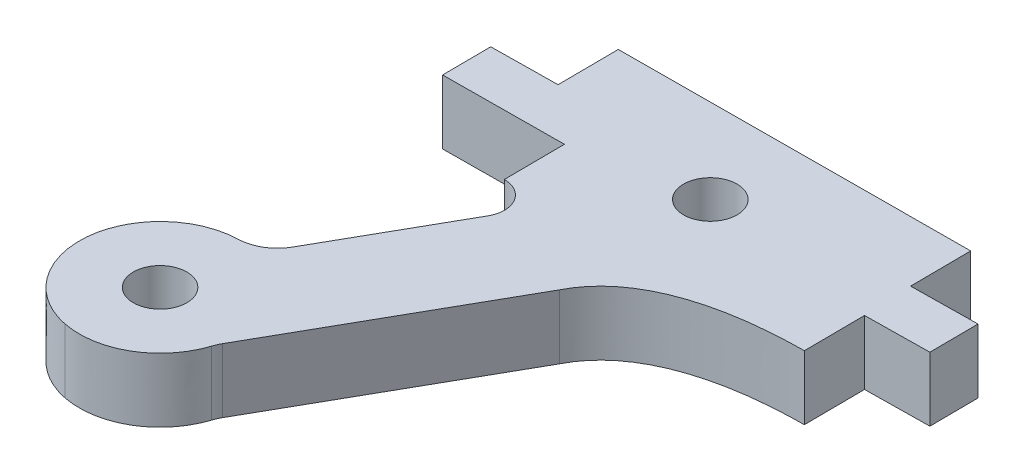
from build123d import *

# Parameters (mm, degrees)
SKETCH1_R           = 1.32389541
SKETCH1_R_2         = 1.323699758
BOSS_EXTRUDE1_DEPTH = 3.175


with BuildPart() as part:
    # Sketch1 → Boss-Extrude1 (new body)
    with BuildSketch(Plane(origin=(0, 0, 0), x_dir=(1, 0, 0), z_dir=(0, 1, 0))):
        with BuildLine():
            Line((-5.766463736, 10.436835071), (-5.763397789, 10.436835071))
            Line((-5.763397789, 10.436835071), (-5.741482849, 7.436754545))
            Line((-5.741482849, 7.436754545), (-5.741482849, 7.43457666))
            Line((-5.741482849, 7.43457666), (-9.035328609, 7.392845258))
            Line((-9.035328609, 7.392845258), (-9.017756687, 4.992874594))
            Line((-9.017756687, 4.992874594), (-3.028577982, 5.036774114))
            Line((-3.028577982, 5.036774114), (-3.006858015, 2.03663499))
            add(Edge.make_bspline(
                [(-3.006858015, 2.03663499), (-2.537212459, 2.04027782), (-2.101492166, 1.792457947), (-1.86369849, 1.386795127)],
                knots=[7, 7, 7, 7, 8, 8, 8, 8], degree=3))
            add(Edge.make_bspline(
                [(-1.86369849, 1.386795127), (-1.625904815, 0.981269034), (-1.622327064, 0.479281193), (-1.854110704, 0.070102504)],
                knots=[8, 8, 8, 8, 9, 9, 9, 9], degree=3))
            Line((-1.854110704, 0.070102504), (-5.351888242, -6.103195522))
            add(Edge.make_bspline(
                [(-5.351888242, -6.103195522), (-5.695800728, -6.710083196), (-6.330407878, -7.093469085), (-7.026733662, -7.115042842)],
                knots=[10, 10, 10, 10, 11, 11, 11, 11], degree=3))
            add(Edge.make_bspline(
                [(-7.026733662, -7.115042842), (-9.053280728, -7.177635062), (-10.711446226, -8.751884558), (-10.882412982, -10.775901488)],
                knots=[11, 11, 11, 11, 12, 12, 12, 12], degree=3))
            add(Edge.make_bspline(
                [(-10.882412982, -10.775901488), (-11.053189639, -12.799977016), (-9.682969691, -14.630953252), (-7.695582907, -15.033920574)],
                knots=[12, 12, 12, 12, 13, 13, 13, 13], degree=3))
            add(Edge.make_bspline(
                [(-7.695582907, -15.033920574), (-5.708322855, -15.436702335), (-3.735061849, -14.283722207), (-3.107161762, -12.352201909)],
                knots=[13, 13, 13, 13, 14, 14, 14, 14], degree=3))
            add(Edge.make_bspline(
                [(-3.107161762, -12.352201909), (-3.065505827, -12.224448933), (-3.011327766, -12.101305651), (-2.945076016, -11.984237008)],
                knots=[14, 14, 14, 14, 15, 15, 15, 15], degree=3))
            Line((-2.945076016, -11.984237008), (3.088122669, -1.336147093))
            add(Edge.make_bspline(
                [(3.088122669, -1.336147093), (4.643620376, 1.757768048), (9.32927932, 2.106844923), (11.766760764, 2.124639123)],
                knots=[16, 16, 16, 16, 17, 17, 17, 17], degree=3))
            add(Edge.make_bspline(
                [(11.766760764, 2.124639123), (11.744850698, 5.124788013), (11.745167529, 5.124788013)],
                knots=[17, 17, 17, 18, 18, 18], degree=2))
            add(Edge.make_bspline(
                [(11.745167529, 5.124788013), (11.7455526, 5.124788013), (14.938899641, 5.168687533)],
                knots=[18, 18, 18, 19, 19, 19], degree=2))
            Line((14.938899641, 5.168687533), (14.92132772, 7.5685996))
            Line((14.92132772, 7.5685996), (11.627486834, 7.524690313))
            Line((11.627486834, 7.524690313), (11.605571894, 10.524643877))
            Line((11.605571894, 10.524643877), (-5.766463736, 10.436835071))
        make_face()
        with Locations(Location((2.951690467, 6.280829877, 0), (0, 0, 270))):
            Circle(SKETCH1_R, mode=Mode.SUBTRACT)
        with Locations(Location((-6.903683904, -11.113205089, 0), (0, 0, 270))):
            Circle(SKETCH1_R_2, mode=Mode.SUBTRACT)
    extrude(amount=BOSS_EXTRUDE1_DEPTH)


solid = part.part
